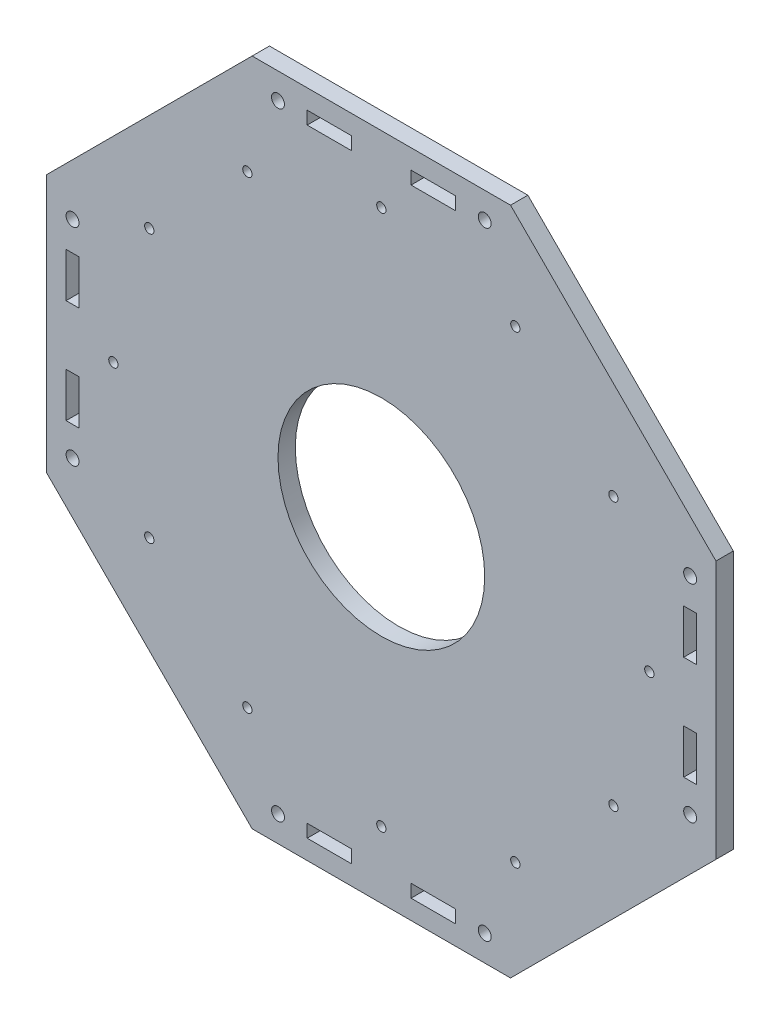
from build123d import *

# Parameters (mm, degrees)
SKETCH1_R           = 109.5
SKETCH1_R_2         = 40
SKETCH1_R_3         = 1.8
BOSS_EXTRUDE1_DEPTH = 6.7
SKETCH4_R           = 109.5
SKETCH4_R_2         = 2.5
SKETCH4_W           = 17.2
SKETCH4_H           = 5
SKETCH4_W_2         = 5
SKETCH4_H_2         = 17.2
BOSS_EXTRUDE2_DEPTH = 6.7


with BuildPart() as part:
    # Sketch1 → Boss-Extrude1 (new body)
    with BuildSketch(Plane.XY):
        Circle(SKETCH1_R)
        Circle(SKETCH1_R_2, mode=Mode.SUBTRACT)
        with Locations((0, 103.7)):
            Circle(SKETCH1_R_3, mode=Mode.SUBTRACT)
        with Locations((51.85, 89.806834372)):
            Circle(SKETCH1_R_3, mode=Mode.SUBTRACT)
        with Locations((89.806834372, 51.85)):
            Circle(SKETCH1_R_3, mode=Mode.SUBTRACT)
        with Locations((103.7, 0)):
            Circle(SKETCH1_R_3, mode=Mode.SUBTRACT)
        with Locations((89.806834372, -51.85)):
            Circle(SKETCH1_R_3, mode=Mode.SUBTRACT)
        with Locations((51.85, -89.806834372)):
            Circle(SKETCH1_R_3, mode=Mode.SUBTRACT)
        with Locations((0, -103.7)):
            Circle(SKETCH1_R_3, mode=Mode.SUBTRACT)
        with Locations((-51.85, -89.806834372)):
            Circle(SKETCH1_R_3, mode=Mode.SUBTRACT)
        with Locations((-89.806834372, -51.85)):
            Circle(SKETCH1_R_3, mode=Mode.SUBTRACT)
        with Locations((-103.7, 0)):
            Circle(SKETCH1_R_3, mode=Mode.SUBTRACT)
        with Locations((-89.806834372, 51.85)):
            Circle(SKETCH1_R_3, mode=Mode.SUBTRACT)
        with Locations((-51.85, 89.806834372)):
            Circle(SKETCH1_R_3, mode=Mode.SUBTRACT)
    extrude(amount=BOSS_EXTRUDE1_DEPTH)

    # Sketch4 → Boss-Extrude2 (add)
    with BuildSketch(Plane.XY):
        Polygon((50, 129.5), (-50, 129.5), (-129.5, 50), (-129.5, -50), (-50, -129.5), (50, -129.5), (129.5, -50), (129.5, 50), align=None)
        Circle(SKETCH4_R, mode=Mode.SUBTRACT)
        with Locations((40, 119.5)):
            Circle(SKETCH4_R_2, mode=Mode.SUBTRACT)
        with Locations(Location((-40, 119.5, 0), (0, 0, 180))):
            Circle(SKETCH4_R_2, mode=Mode.SUBTRACT)
        with Locations(Location((119.5, 40, 0), (0, 0, 180))):
            Circle(SKETCH4_R_2, mode=Mode.SUBTRACT)
        with Locations((119.5, -40)):
            Circle(SKETCH4_R_2, mode=Mode.SUBTRACT)
        with Locations(Location((40, -119.5, 0), (0, 0, 180))):
            Circle(SKETCH4_R_2, mode=Mode.SUBTRACT)
        with Locations((-40, -119.5)):
            Circle(SKETCH4_R_2, mode=Mode.SUBTRACT)
        with Locations(Location((-119.5, -40, 0), (0, 0, 180))):
            Circle(SKETCH4_R_2, mode=Mode.SUBTRACT)
        with Locations((-119.5, 40)):
            Circle(SKETCH4_R_2, mode=Mode.SUBTRACT)
        with Locations((20.1, 119.5)):
            Rectangle(SKETCH4_W, SKETCH4_H, mode=Mode.SUBTRACT)
        with Locations((-20.1, 119.5)):
            Rectangle(SKETCH4_W, SKETCH4_H, mode=Mode.SUBTRACT)
        with Locations((119.5, 20.1)):
            Rectangle(SKETCH4_W_2, SKETCH4_H_2, mode=Mode.SUBTRACT)
        with Locations((119.5, -20.1)):
            Rectangle(SKETCH4_W_2, SKETCH4_H_2, mode=Mode.SUBTRACT)
        with Locations((20.1, -119.5)):
            Rectangle(SKETCH4_W, SKETCH4_H, mode=Mode.SUBTRACT)
        with Locations((-20.1, -119.5)):
            Rectangle(SKETCH4_W, SKETCH4_H, mode=Mode.SUBTRACT)
        with Locations((-119.5, -20.1)):
            Rectangle(SKETCH4_W_2, SKETCH4_H_2, mode=Mode.SUBTRACT)
        with Locations((-119.5, 20.1)):
            Rectangle(SKETCH4_W_2, SKETCH4_H_2, mode=Mode.SUBTRACT)
    extrude(amount=BOSS_EXTRUDE2_DEPTH)


solid = part.part
